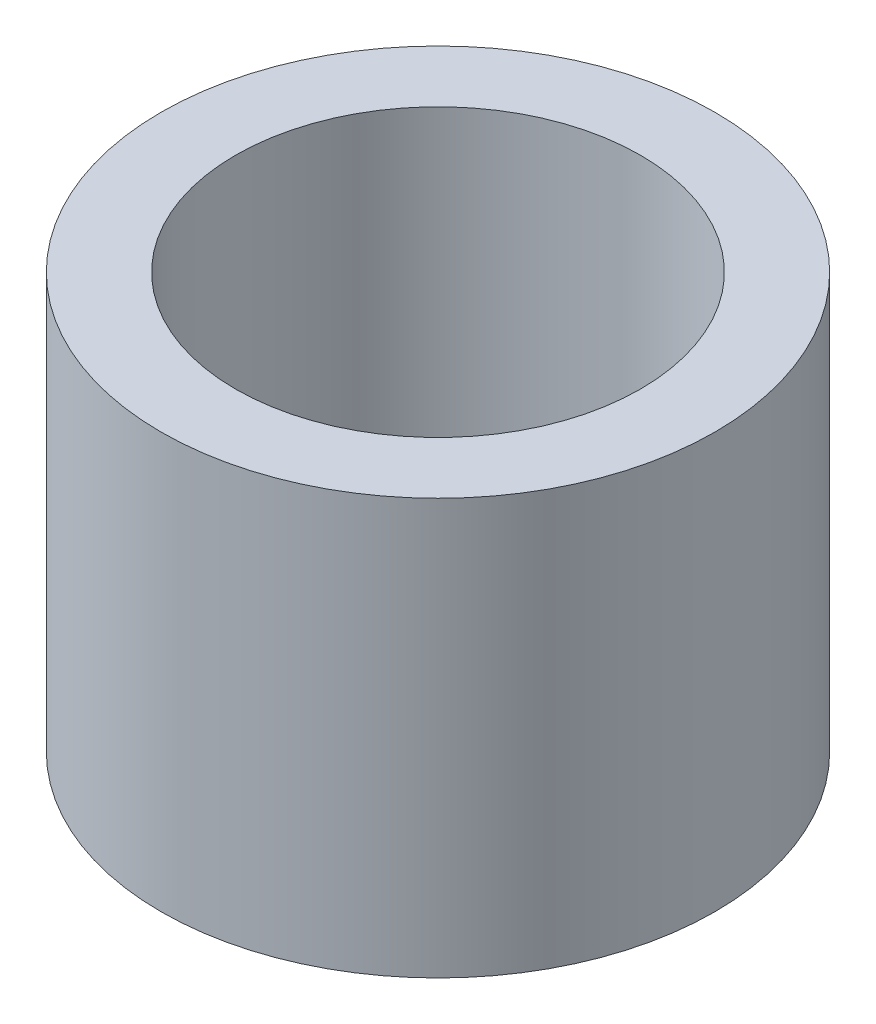
from build123d import *

# Parameters (mm, degrees)
SKETCH1_R           = 4
BOSS_EXTRUDE1_DEPTH = 6
SKETCH2_R           = 2.925
CUT_EXTRUDE1_DEPTH  = 10


with BuildPart() as part:
    # Sketch1 → Boss-Extrude1 (new body)
    with BuildSketch(Plane(origin=(0, 0, 0), x_dir=(1, 0, 0), z_dir=(0, 1, 0))):
        with Locations(Location((0, 0, 0), (0, 0, 270))):
            Circle(SKETCH1_R)
    extrude(amount=BOSS_EXTRUDE1_DEPTH)

    # Sketch2 → Cut-Extrude1 (cut)
    with BuildSketch(Plane(origin=(0, 6, 0), x_dir=(1, 0, 0), z_dir=(0, 1, 0))):
        with Locations(Location((0, 0, 0), (0, 0, 270))):
            Circle(SKETCH2_R)
    extrude(amount=-CUT_EXTRUDE1_DEPTH, mode=Mode.SUBTRACT)


solid = part.part
